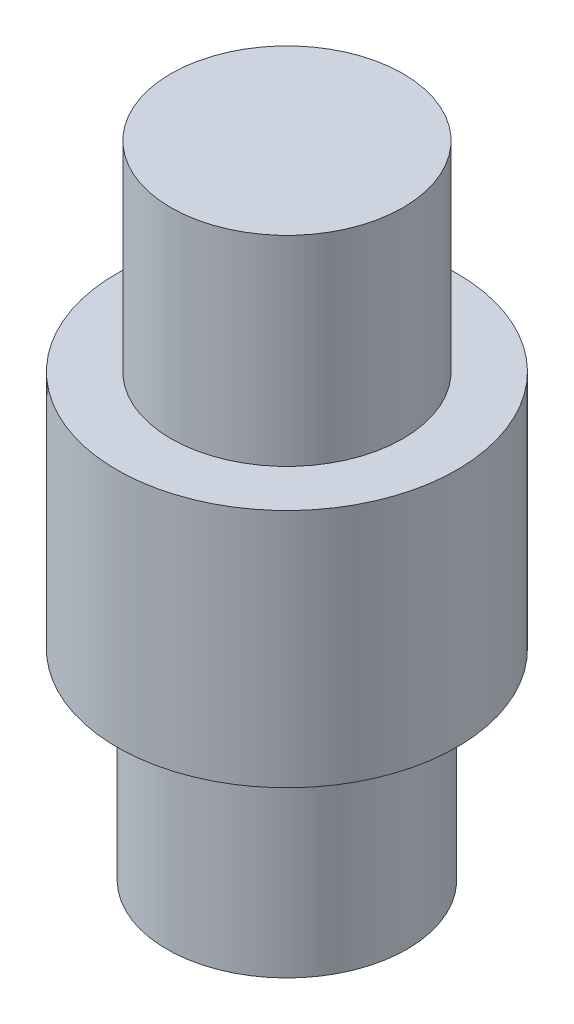
from build123d import *

# Parameters (mm, degrees)
SKETCH1_R           = 1.45
BOSS_EXTRUDE1_DEPTH = 2.5
SKETCH2_R           = 2.125
BOSS_EXTRUDE2_DEPTH = 3
SKETCH3_R           = 1.5
BOSS_EXTRUDE3_DEPTH = 2.5


with BuildPart() as part:
    # Sketch1 → Boss-Extrude1 (new body)
    with BuildSketch(Plane(origin=(0, 0, 0), x_dir=(1, 0, 0), z_dir=(0, 1, 0))):
        with Locations(Location((0, 0, 0), (0, 0, 270))):
            Circle(SKETCH1_R)
    extrude(amount=BOSS_EXTRUDE1_DEPTH)

    # Sketch2 → Boss-Extrude2 (add)
    with BuildSketch(Plane.XZ):
        with Locations(Location((0, 0, 0), (0, 0, 270))):
            Circle(SKETCH2_R)
    extrude(amount=BOSS_EXTRUDE2_DEPTH)

    # Sketch3 → Boss-Extrude3 (add)
    with BuildSketch(Plane.XZ.offset(3)):
        with Locations(Location((0, 0, 0), (0, 0, 270))):
            Circle(SKETCH3_R)
    extrude(amount=BOSS_EXTRUDE3_DEPTH)


solid = part.part
